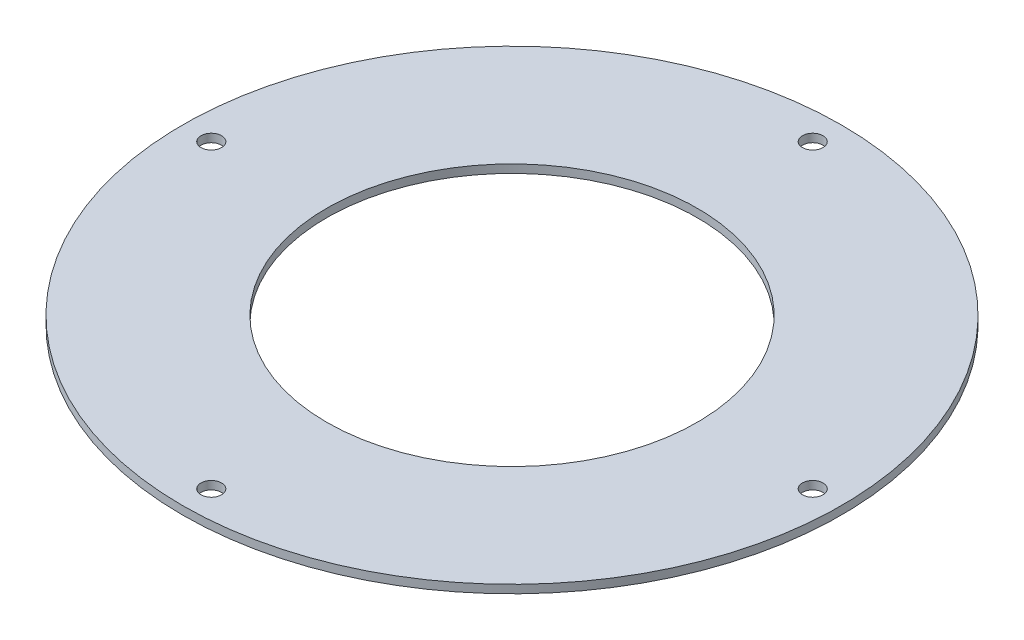
from build123d import *

# Parameters (mm, degrees)
SKETCH1_R           = 80
SKETCH1_R_2         = 45
BOSS_EXTRUDE1_DEPTH = 2
SKETCH2_R           = 2.5
CUT_EXTRUDE1_DEPTH  = 114.154761279


with BuildPart() as part:
    # Sketch1 → Boss-Extrude1 (new body)
    with BuildSketch(Plane(origin=(0, 0, 0), x_dir=(1, 0, 0), z_dir=(0, 1, 0))):
        with Locations(Location((0, 0, 0), (0, 0, 270))):
            Circle(SKETCH1_R)
        with Locations(Location((0, 0, 0), (0, 0, 270))):
            Circle(SKETCH1_R_2, mode=Mode.SUBTRACT)
    extrude(amount=BOSS_EXTRUDE1_DEPTH)

    # Sketch2 → Cut-Extrude1 (cut, through all)
    with BuildSketch(Plane(origin=(0, 2, 0), x_dir=(1, 0, 0), z_dir=(0, 1, 0))):
        with Locations(Location((0, 73, 0), (0, 0, 270))):
            Circle(SKETCH2_R)
        with Locations(Location((73, 0, 0), (0, 0, 270))):
            Circle(SKETCH2_R)
        with Locations(Location((0, -73, 0), (0, 0, 270))):
            Circle(SKETCH2_R)
        with Locations(Location((-73, 0, 0), (0, 0, 270))):
            Circle(SKETCH2_R)
    extrude(amount=-CUT_EXTRUDE1_DEPTH, mode=Mode.SUBTRACT)


solid = part.part
